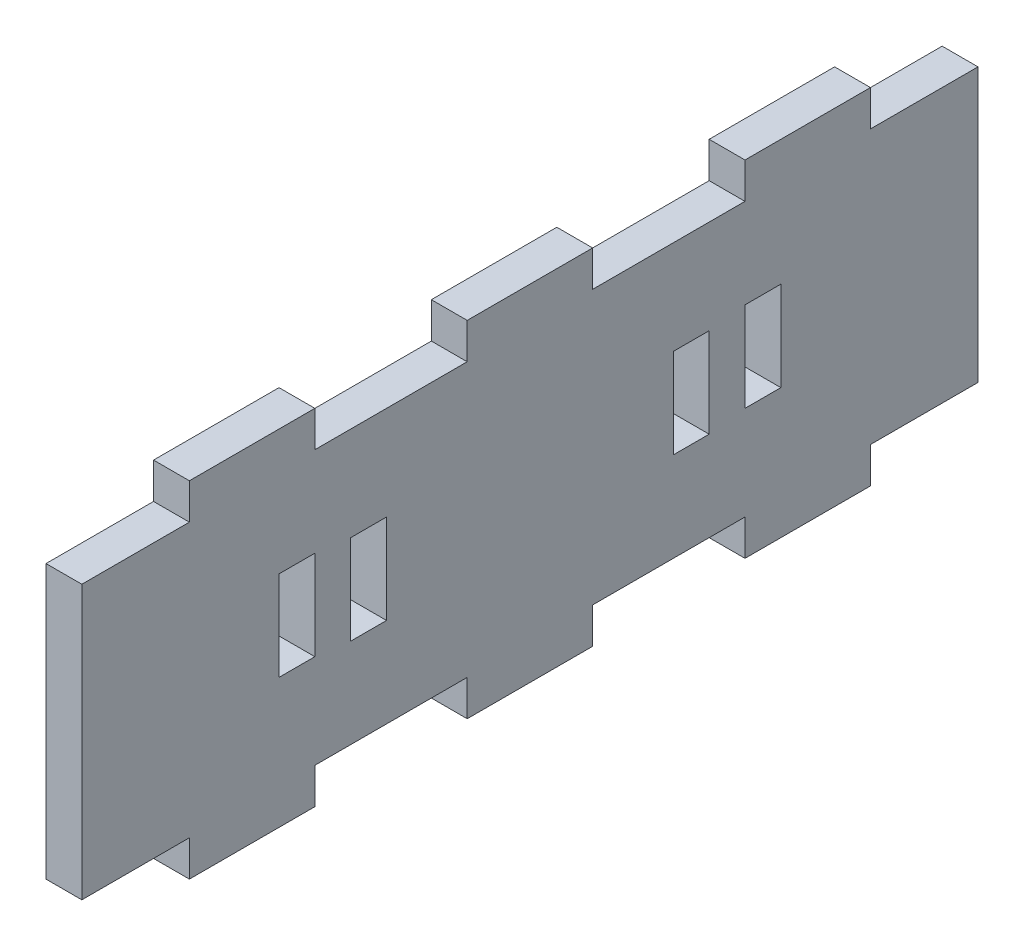
from build123d import *

# Parameters (mm, degrees)
SKETCH1_W           = 50
SKETCH1_H           = 15.25
SKETCH1_W_2         = 2
SKETCH1_H_2         = 5
SKETCH1_W_3         = 7
SKETCH1_H_3         = 2
BOSS_EXTRUDE1_DEPTH = 2


with BuildPart() as part:
    # Sketch1 → Boss-Extrude1 (new body)
    # profile 1 of 7: a face of its own
    with BuildSketch(Plane(origin=(0, 0, 0), x_dir=(0, 0, -1), z_dir=(1, 0, 0))):
        Rectangle(SKETCH1_W, SKETCH1_H)
        with Locations((-9, -0.125)):
            Rectangle(SKETCH1_W_2, SKETCH1_H_2, mode=Mode.SUBTRACT)
        with Locations((9, -0.125)):
            Rectangle(SKETCH1_W_2, SKETCH1_H_2, mode=Mode.SUBTRACT)
        with Locations((-13, 0.125)):
            Rectangle(SKETCH1_W_2, SKETCH1_H_2, mode=Mode.SUBTRACT)
        with Locations((13, 0.125)):
            Rectangle(SKETCH1_W_2, SKETCH1_H_2, mode=Mode.SUBTRACT)
    # profile 2 of 7: a face of its own
    with BuildSketch(Plane(origin=(0, 0, 0), x_dir=(0, 0, -1), z_dir=(1, 0, 0))):
        with Locations((-15.5, -8.625)):
            Rectangle(SKETCH1_W_3, SKETCH1_H_3)
    # profile 3 of 7: a face of its own
    with BuildSketch(Plane(origin=(0, 0, 0), x_dir=(0, 0, -1), z_dir=(1, 0, 0))):
        with Locations((0, -8.625)):
            Rectangle(SKETCH1_W_3, SKETCH1_H_3)
    # profile 4 of 7: a face of its own
    with BuildSketch(Plane(origin=(0, 0, 0), x_dir=(0, 0, -1), z_dir=(1, 0, 0))):
        with Locations((15.5, -8.625)):
            Rectangle(SKETCH1_W_3, SKETCH1_H_3)
    # profile 5 of 7: a face of its own
    with BuildSketch(Plane(origin=(0, 0, 0), x_dir=(0, 0, -1), z_dir=(1, 0, 0))):
        with Locations((-15.5, 8.625)):
            Rectangle(SKETCH1_W_3, SKETCH1_H_3)
    # profile 6 of 7: a face of its own
    with BuildSketch(Plane(origin=(0, 0, 0), x_dir=(0, 0, -1), z_dir=(1, 0, 0))):
        with Locations((0, 8.625)):
            Rectangle(SKETCH1_W_3, SKETCH1_H_3)
    # profile 7 of 7: a face of its own
    with BuildSketch(Plane(origin=(0, 0, 0), x_dir=(0, 0, -1), z_dir=(1, 0, 0))):
        with Locations((15.5, 8.625)):
            Rectangle(SKETCH1_W_3, SKETCH1_H_3)
    extrude(amount=BOSS_EXTRUDE1_DEPTH)


solid = part.part
